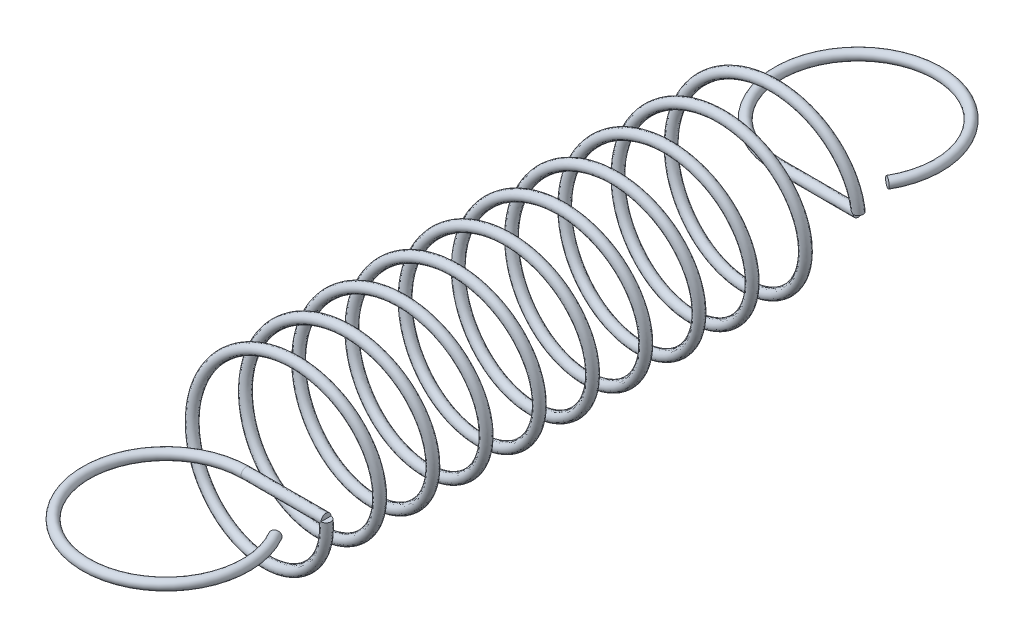
from build123d import *

# Parameters (mm, degrees)
BALAYAGE1_PITCH       = 1.88
BALAYAGE1_HEIGHT      = 18.8
BALAYAGE1_RADIUS      = 2.825
BALAYAGE1_START_ANGLE = 180
ESQUISSE2_R           = 0.175
ESQUISSE11_R          = 0.175
ESQUISSE13_R          = 0.175


with BuildPart() as part:
    # Balayage1: sweep along a helix
    with BuildLine() as balayage1_path:
        add(Helix(BALAYAGE1_PITCH, BALAYAGE1_HEIGHT, BALAYAGE1_RADIUS, center=(0, 0, 0), direction=(0, 0, -1), mode=Mode.PRIVATE).rotate(Axis((0, 0, 0), (0, 0, -1)), BALAYAGE1_START_ANGLE))
    # Esquisse2 → Balayage1 (sweep)
    with BuildSketch(Plane(origin=(0, 0, 0), x_dir=(1, 0, 0), z_dir=(0, 1, 0))):
        with Locations((2.824999435, 18.799813189)):
            Circle(ESQUISSE2_R)
    sweep(path=balayage1_path.line, is_frenet=True)

    # Balayage2: sweep along a path in Esquisse10
    with BuildLine(Plane(origin=(0, 0, 0), x_dir=(1, 0, 0), z_dir=(0, 1, 0))) as balayage2_path:
        Line((2.824999435, -0.000186811), (0, 0))
    # Esquisse11 → Balayage2 (sweep)
    with BuildSketch(Plane(origin=(2.824999435, 0, 0), x_dir=(0, 0, -1), z_dir=(1, 0, 0))):
        with Locations((-0.000186811, 0)):
            Circle(ESQUISSE11_R)
    balayage2 = sweep(path=balayage2_path.line)

    # Balayage3: sweep along a path in Esquisse12
    with BuildLine(Plane(origin=(0, 0, 0), x_dir=(1, 0, 0), z_dir=(0, 1, 0))) as balayage3_path:
        ThreePointArc((0, 0), (-1.4125, -5.271521766), (2.446521766, -1.4125))
    # Esquisse13 → Balayage3 (sweep)
    with BuildSketch(Plane.ZY):
        Circle(ESQUISSE13_R)
    balayage3 = sweep(path=balayage3_path.line)

    # Symétrie1: Balayage2, Balayage3 across plane
    add(balayage2.mirror(Plane(origin=(0, 0, -9.399813189), x_dir=(1, 0, 0), z_dir=(0, 0, -1))))
    add(balayage3.mirror(Plane(origin=(0, 0, -9.399813189), x_dir=(1, 0, 0), z_dir=(0, 0, -1))))


solid = part.part
